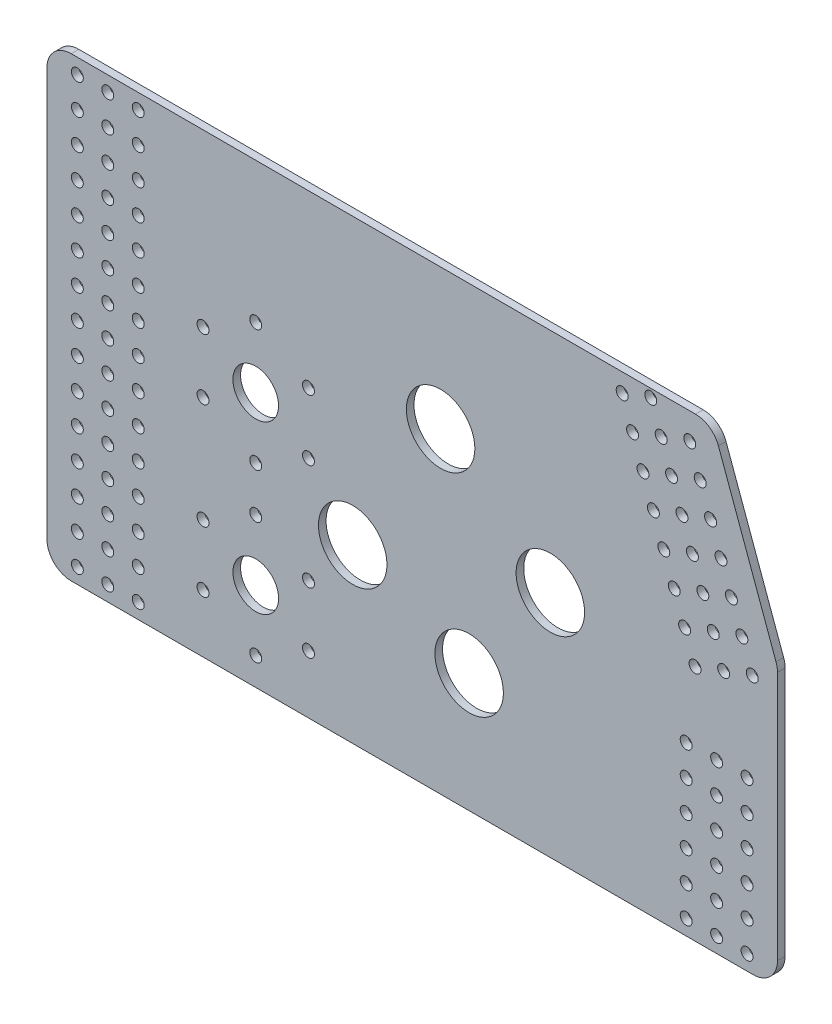
from build123d import *

# Parameters (mm, degrees)
SKETCH1_R           = 2.4892
SKETCH1_R_2         = 14.2875
SKETCH1_R_3         = 9.525
BOSS_EXTRUDE1_DEPTH = 3.175
BOSS_EXTRUDE2_START = -3.175
SKETCH2_R           = 2.4892
BOSS_EXTRUDE2_DEPTH = 3.175
FILLET1_R           = 10.16


with BuildPart() as part:
    # Sketch1 → Boss-Extrude1 (new body)
    with BuildSketch(Plane.XY):
        Polygon((-152.4, 0), (152.4, 0), (152.4, 116.084254136), (125.314883545, 190.5), (-152.4, 190.5), align=None)
        with Locations((-139.7, 184.15)):
            Circle(SKETCH1_R, mode=Mode.SUBTRACT)
        with Locations((-127, 184.15)):
            Circle(SKETCH1_R, mode=Mode.SUBTRACT)
        with Locations((-114.3, 184.15)):
            Circle(SKETCH1_R, mode=Mode.SUBTRACT)
        with Locations((-127, 171.45)):
            Circle(SKETCH1_R, mode=Mode.SUBTRACT)
        with Locations((-114.3, 171.45)):
            Circle(SKETCH1_R, mode=Mode.SUBTRACT)
        with Locations((-127, 158.75)):
            Circle(SKETCH1_R, mode=Mode.SUBTRACT)
        with Locations((-114.3, 158.75)):
            Circle(SKETCH1_R, mode=Mode.SUBTRACT)
        with Locations((-127, 146.05)):
            Circle(SKETCH1_R, mode=Mode.SUBTRACT)
        with Locations((-114.3, 146.05)):
            Circle(SKETCH1_R, mode=Mode.SUBTRACT)
        with Locations((-127, 133.35)):
            Circle(SKETCH1_R, mode=Mode.SUBTRACT)
        with Locations((-114.3, 133.35)):
            Circle(SKETCH1_R, mode=Mode.SUBTRACT)
        with Locations((-127, 120.65)):
            Circle(SKETCH1_R, mode=Mode.SUBTRACT)
        with Locations((-114.3, 120.65)):
            Circle(SKETCH1_R, mode=Mode.SUBTRACT)
        with Locations((-127, 107.95)):
            Circle(SKETCH1_R, mode=Mode.SUBTRACT)
        with Locations((-114.3, 107.95)):
            Circle(SKETCH1_R, mode=Mode.SUBTRACT)
        with Locations((-127, 95.25)):
            Circle(SKETCH1_R, mode=Mode.SUBTRACT)
        with Locations((-114.3, 95.25)):
            Circle(SKETCH1_R, mode=Mode.SUBTRACT)
        with Locations((-127, 82.55)):
            Circle(SKETCH1_R, mode=Mode.SUBTRACT)
        with Locations((-114.3, 82.55)):
            Circle(SKETCH1_R, mode=Mode.SUBTRACT)
        with Locations((-127, 69.85)):
            Circle(SKETCH1_R, mode=Mode.SUBTRACT)
        with Locations((-114.3, 69.85)):
            Circle(SKETCH1_R, mode=Mode.SUBTRACT)
        with Locations((-127, 57.15)):
            Circle(SKETCH1_R, mode=Mode.SUBTRACT)
        with Locations((-114.3, 57.15)):
            Circle(SKETCH1_R, mode=Mode.SUBTRACT)
        with Locations((-127, 44.45)):
            Circle(SKETCH1_R, mode=Mode.SUBTRACT)
        with Locations((-114.3, 44.45)):
            Circle(SKETCH1_R, mode=Mode.SUBTRACT)
        with Locations((-127, 31.75)):
            Circle(SKETCH1_R, mode=Mode.SUBTRACT)
        with Locations((-114.3, 31.75)):
            Circle(SKETCH1_R, mode=Mode.SUBTRACT)
        with Locations((-127, 19.05)):
            Circle(SKETCH1_R, mode=Mode.SUBTRACT)
        with Locations((-114.3, 19.05)):
            Circle(SKETCH1_R, mode=Mode.SUBTRACT)
        with Locations((-127, 6.35)):
            Circle(SKETCH1_R, mode=Mode.SUBTRACT)
        with Locations((-114.3, 6.35)):
            Circle(SKETCH1_R, mode=Mode.SUBTRACT)
        with Locations((-139.7, 171.45)):
            Circle(SKETCH1_R, mode=Mode.SUBTRACT)
        with Locations((-139.7, 158.75)):
            Circle(SKETCH1_R, mode=Mode.SUBTRACT)
        with Locations((-139.7, 146.05)):
            Circle(SKETCH1_R, mode=Mode.SUBTRACT)
        with Locations((-139.7, 133.35)):
            Circle(SKETCH1_R, mode=Mode.SUBTRACT)
        with Locations((-139.7, 120.65)):
            Circle(SKETCH1_R, mode=Mode.SUBTRACT)
        with Locations((-139.7, 107.95)):
            Circle(SKETCH1_R, mode=Mode.SUBTRACT)
        with Locations((-139.7, 95.25)):
            Circle(SKETCH1_R, mode=Mode.SUBTRACT)
        with Locations((-139.7, 82.55)):
            Circle(SKETCH1_R, mode=Mode.SUBTRACT)
        with Locations((-139.7, 69.85)):
            Circle(SKETCH1_R, mode=Mode.SUBTRACT)
        with Locations((-139.7, 57.15)):
            Circle(SKETCH1_R, mode=Mode.SUBTRACT)
        with Locations((-139.7, 44.45)):
            Circle(SKETCH1_R, mode=Mode.SUBTRACT)
        with Locations((-139.7, 31.75)):
            Circle(SKETCH1_R, mode=Mode.SUBTRACT)
        with Locations((-139.7, 19.05)):
            Circle(SKETCH1_R, mode=Mode.SUBTRACT)
        with Locations((-139.7, 6.35)):
            Circle(SKETCH1_R, mode=Mode.SUBTRACT)
        with Locations((87.590706137, 182.74937795)):
            Circle(SKETCH1_R, mode=Mode.SUBTRACT)
        with Locations((99.524802421, 187.09303377)):
            Circle(SKETCH1_R, mode=Mode.SUBTRACT)
        with Locations((115.802554525, 179.502593307)):
            Circle(SKETCH1_R, mode=Mode.SUBTRACT)
        with Locations((91.934361957, 170.815281666)):
            Circle(SKETCH1_R, mode=Mode.SUBTRACT)
        with Locations((103.868458241, 175.158937486)):
            Circle(SKETCH1_R, mode=Mode.SUBTRACT)
        with Locations((120.146210345, 167.568497023)):
            Circle(SKETCH1_R, mode=Mode.SUBTRACT)
        with Locations((96.278017777, 158.881185382)):
            Circle(SKETCH1_R, mode=Mode.SUBTRACT)
        with Locations((108.212114061, 163.224841202)):
            Circle(SKETCH1_R, mode=Mode.SUBTRACT)
        with Locations((124.489866165, 155.634400739)):
            Circle(SKETCH1_R, mode=Mode.SUBTRACT)
        with Locations((100.621673597, 146.947089098)):
            Circle(SKETCH1_R, mode=Mode.SUBTRACT)
        with Locations((112.555769881, 151.290744918)):
            Circle(SKETCH1_R, mode=Mode.SUBTRACT)
        with Locations((128.833521986, 143.700304455)):
            Circle(SKETCH1_R, mode=Mode.SUBTRACT)
        with Locations((104.965329418, 135.012992814)):
            Circle(SKETCH1_R, mode=Mode.SUBTRACT)
        with Locations((116.899425702, 139.356648634)):
            Circle(SKETCH1_R, mode=Mode.SUBTRACT)
        with Locations((133.177177806, 131.766208171)):
            Circle(SKETCH1_R, mode=Mode.SUBTRACT)
        with Locations((109.308985238, 123.07889653)):
            Circle(SKETCH1_R, mode=Mode.SUBTRACT)
        with Locations((121.243081522, 127.42255235)):
            Circle(SKETCH1_R, mode=Mode.SUBTRACT)
        with Locations((137.520833626, 119.832111887)):
            Circle(SKETCH1_R, mode=Mode.SUBTRACT)
        with Locations((113.652641058, 111.144800246)):
            Circle(SKETCH1_R, mode=Mode.SUBTRACT)
        with Locations((125.586737342, 115.488456066)):
            Circle(SKETCH1_R, mode=Mode.SUBTRACT)
        with Locations((141.864489446, 107.898015603)):
            Circle(SKETCH1_R, mode=Mode.SUBTRACT)
        with Locations((117.996296878, 99.210703962)):
            Circle(SKETCH1_R, mode=Mode.SUBTRACT)
        with Locations((129.930393162, 103.554359782)):
            Circle(SKETCH1_R, mode=Mode.SUBTRACT)
        with Locations((146.208145266, 95.963919319)):
            Circle(SKETCH1_R, mode=Mode.SUBTRACT)
        with Locations((114.3, 69.85)):
            Circle(SKETCH1_R, mode=Mode.SUBTRACT)
        with Locations((127, 69.85)):
            Circle(SKETCH1_R, mode=Mode.SUBTRACT)
        with Locations((139.7, 69.85)):
            Circle(SKETCH1_R, mode=Mode.SUBTRACT)
        with Locations((114.3, 57.15)):
            Circle(SKETCH1_R, mode=Mode.SUBTRACT)
        with Locations((127, 57.15)):
            Circle(SKETCH1_R, mode=Mode.SUBTRACT)
        with Locations((139.7, 57.15)):
            Circle(SKETCH1_R, mode=Mode.SUBTRACT)
        with Locations((114.3, 44.45)):
            Circle(SKETCH1_R, mode=Mode.SUBTRACT)
        with Locations((127, 44.45)):
            Circle(SKETCH1_R, mode=Mode.SUBTRACT)
        with Locations((139.7, 44.45)):
            Circle(SKETCH1_R, mode=Mode.SUBTRACT)
        with Locations((114.3, 31.75)):
            Circle(SKETCH1_R, mode=Mode.SUBTRACT)
        with Locations((127, 31.75)):
            Circle(SKETCH1_R, mode=Mode.SUBTRACT)
        with Locations((139.7, 31.75)):
            Circle(SKETCH1_R, mode=Mode.SUBTRACT)
        with Locations((114.3, 19.05)):
            Circle(SKETCH1_R, mode=Mode.SUBTRACT)
        with Locations((127, 19.05)):
            Circle(SKETCH1_R, mode=Mode.SUBTRACT)
        with Locations((139.7, 19.05)):
            Circle(SKETCH1_R, mode=Mode.SUBTRACT)
        with Locations((114.3, 6.35)):
            Circle(SKETCH1_R, mode=Mode.SUBTRACT)
        with Locations((127, 6.35)):
            Circle(SKETCH1_R, mode=Mode.SUBTRACT)
        with Locations((139.7, 6.35)):
            Circle(SKETCH1_R, mode=Mode.SUBTRACT)
        with Locations((11.850775283, 132.016841695)):
            Circle(SKETCH1_R_2, mode=Mode.SUBTRACT)
        with Locations((-24.819733341, 71.744857423)):
            Circle(SKETCH1_R_2, mode=Mode.SUBTRACT)
        with Locations((57.635078008, 95.712451111)):
            Circle(SKETCH1_R_2, mode=Mode.SUBTRACT)
        with Locations((23.754601626, 49.678686248)):
            Circle(SKETCH1_R_2, mode=Mode.SUBTRACT)
        with Locations((-65.270180641, 36.953448556)):
            Circle(SKETCH1_R_3, mode=Mode.SUBTRACT)
        with Locations((-65.270180641, 106.549448556)):
            Circle(SKETCH1_R_3, mode=Mode.SUBTRACT)
        with Locations((-65.270180641, 131.949448556)):
            Circle(SKETCH1_R, mode=Mode.SUBTRACT)
        with Locations((-65.270180641, 11.553448556)):
            Circle(SKETCH1_R, mode=Mode.SUBTRACT)
        with Locations((-43.273135384, 119.249448556)):
            Circle(SKETCH1_R, mode=Mode.SUBTRACT)
        with Locations((-43.273135384, 93.849448556)):
            Circle(SKETCH1_R, mode=Mode.SUBTRACT)
        with Locations((-65.270180641, 81.149448556)):
            Circle(SKETCH1_R, mode=Mode.SUBTRACT)
        with Locations((-87.267225897, 93.849448556)):
            Circle(SKETCH1_R, mode=Mode.SUBTRACT)
        with Locations((-87.267225897, 119.249448556)):
            Circle(SKETCH1_R, mode=Mode.SUBTRACT)
        with Locations((-87.267225897, 24.253448556)):
            Circle(SKETCH1_R, mode=Mode.SUBTRACT)
        with Locations((-87.267225897, 49.653448556)):
            Circle(SKETCH1_R, mode=Mode.SUBTRACT)
        with Locations((-65.270180641, 62.353448556)):
            Circle(SKETCH1_R, mode=Mode.SUBTRACT)
        with Locations((-43.273135384, 49.653448556)):
            Circle(SKETCH1_R, mode=Mode.SUBTRACT)
        with Locations((-43.273135384, 24.253448556)):
            Circle(SKETCH1_R, mode=Mode.SUBTRACT)
    extrude(amount=BOSS_EXTRUDE1_DEPTH)

    # Sketch2 → Boss-Extrude2 (add)
    with BuildSketch(Plane.XY.offset(3.175).offset(BOSS_EXTRUDE2_START)):
        with Locations((146.208145266, 95.963919319)):
            Circle(SKETCH2_R)
    extrude(amount=BOSS_EXTRUDE2_DEPTH)

    # Fillet1
    fillet1_edges = [part.edges().sort_by_distance(p)[0] for p in [
        (-152.4, 190.5, 1.5875),
        (125.314883545, 190.5, 1.5875),
        (152.4, 116.084254136, 1.5875),
        (152.4, 0, 1.5875),
        (-152.4, 0, 1.5875),
    ]]
    fillet(fillet1_edges, radius=FILLET1_R)


solid = part.part
